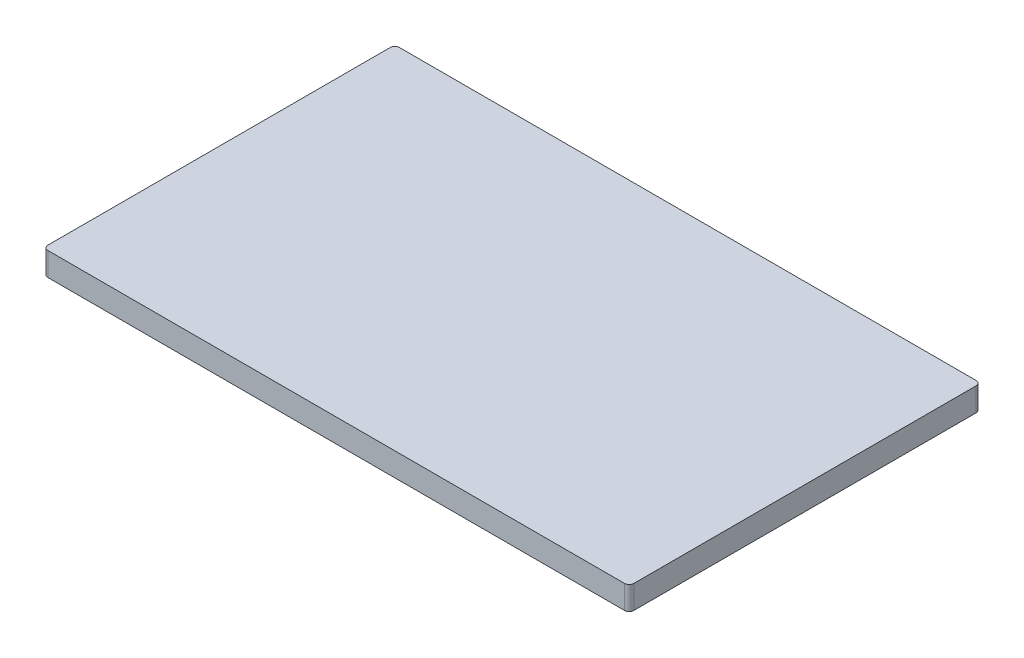
from build123d import *

# Parameters (mm, degrees)
SKETCH1_W           = 317.5
SKETCH1_H           = 190.5
BOSS_EXTRUDE1_DEPTH = 12.7
FILLET1_R           = 2.54


with BuildPart() as part:
    # Sketch1 → Boss-Extrude1 (new body)
    with BuildSketch(Plane(origin=(0, 0, 0), x_dir=(1, 0, 0), z_dir=(0, 1, 0))):
        with Locations((158.75, 95.25)):
            Rectangle(SKETCH1_W, SKETCH1_H)
    extrude(amount=BOSS_EXTRUDE1_DEPTH)

    # Fillet1
    fillet1_edges = [part.edges().sort_by_distance(p)[0] for p in [
        (0, 6.35, -190.5),
        (317.5, 6.35, -190.5),
        (317.5, 6.35, 0),
        (0, 6.35, 0),
    ]]
    fillet(fillet1_edges, radius=FILLET1_R)


solid = part.part
